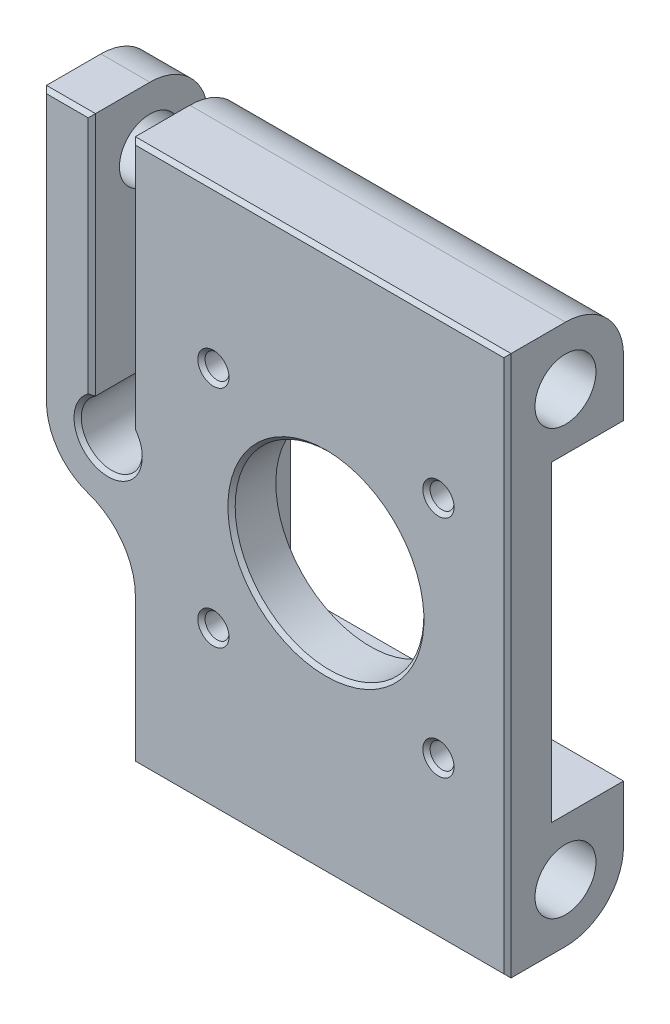
from build123d import *

# Parameters (mm, degrees)
BOSS_EXTRUDE1_DEPTH = 45.9
BOSS_EXTRUDE2_START = 5.85
BOSS_EXTRUDE2_DEPTH = 5.85
SKETCH5_R           = 13
CUT_EXTRUDE1_DEPTH  = 107.896512669
BOSS_EXTRUDE3_DEPTH = 16
CUT_EXTRUDE3_DEPTH  = 108.63296159
FILLET2_R           = 9
SKETCH6_R           = 4.2
CUT_EXTRUDE2_DEPTH  = 148.343120723
SKETCH9_R           = 1.65
CUT_EXTRUDE5_DEPTH  = 107.896512669
CIRPATTERN1_COUNT   = 4
CUT_EXTRUDE6_DEPTH  = 145.539121778
CHAMFER1_SIZE       = 0.5


with BuildPart() as part:
    # Sketch2 → Boss-Extrude1 (new body)
    with BuildSketch(Plane(origin=(0, 0, 0), x_dir=(0, 0, -1), z_dir=(1, 0, 0))):
        with BuildLine():
            Line((-75.607591408, 29.531476198), (-75.607591408, 37.281476198))
            Line((-75.607591408, 37.281476198), (-85.507591408, 37.281476198))
            Line((-85.507591408, 37.281476198), (-85.507591408, 80.281476198))
            Line((-85.507591408, 80.281476198), (-75.607591408, 80.281476198))
            Line((-75.607591408, 80.281476198), (-75.607591408, 88.031476198))
            ThreePointArc((-75.607591408, 88.031476198), (-77.950737158, 93.688330447), (-83.607591408, 96.031476198))
            Line((-83.607591408, 96.031476198), (-91.607591408, 96.031476198))
            Line((-91.607591408, 96.031476198), (-91.607591408, 21.531476198))
            Line((-91.607591408, 21.531476198), (-83.607591408, 21.531476198))
            ThreePointArc((-83.607591408, 21.531476198), (-77.950737158, 23.874621948), (-75.607591408, 29.531476198))
        make_face()
    extrude(amount=BOSS_EXTRUDE1_DEPTH)

    # Sketch3 → Boss-Extrude2 (add)
    with BuildSketch(Plane.ZY.offset(BOSS_EXTRUDE2_START)):
        with BuildLine():
            Line((75.607591408, 37.281476198), (75.607591408, 80.281476198))
            Line((75.607591408, 80.281476198), (75.607591408, 88.031476198))
            ThreePointArc((75.607591408, 88.031476198), (77.950737158, 93.688330447), (83.607591408, 96.031476198))
            Line((83.607591408, 96.031476198), (91.607591408, 96.031476198))
            Line((91.607591408, 96.031476198), (91.607591408, 21.531476198))
            Line((91.607591408, 21.531476198), (83.607591408, 21.531476198))
            ThreePointArc((83.607591408, 21.531476198), (77.950737158, 23.874621948), (75.607591408, 29.531476198))
            Line((75.607591408, 29.531476198), (75.607591408, 37.281476198))
        make_face()
    extrude(amount=-BOSS_EXTRUDE2_DEPTH)

    # Sketch5 → Cut-Extrude1 (cut, through all)
    with BuildSketch(Plane(origin=(0, 0, 85.507591408), x_dir=(-1, 0, 0), z_dir=(0, 0, -1))):
        with Locations(Location((-20.9, 58.781476198, 0), (0, 0, 90))):
            Circle(SKETCH5_R)
    extrude(amount=-CUT_EXTRUDE1_DEPTH, mode=Mode.SUBTRACT)

    # Sketch7 → Boss-Extrude3 (add)
    with BuildSketch(Plane(origin=(0, 0, 75.607591408), x_dir=(-1, 0, 0), z_dir=(0, 0, -1))):
        with BuildLine():
            ThreePointArc((5.85, 50.388771032), (14.186747487, 51.356854995), (18.1, 58.781476198))
            Line((18.1, 58.781476198), (18.1, 96.031476198))
            Line((18.1, 96.031476198), (11.35, 96.031476198))
            Line((11.35, 96.031476198), (11.35, 62.327953323))
            ThreePointArc((11.35, 62.327953323), (12.243437264, 55.996013549), (5.85, 56.121119079))
            Line((5.85, 56.121119079), (5.85, 50.388771032))
        make_face()
    extrude(amount=-BOSS_EXTRUDE3_DEPTH)

    # Sketch7<3> → Cut-Extrude3 (cut, through all)
    with BuildSketch(Plane(origin=(0, 0, 75.607591408), x_dir=(-1, 0, 0), z_dir=(0, 0, -1))):
        with BuildLine():
            ThreePointArc((5.85, 61.441833317), (4.9, 58.781476198), (5.85, 56.121119079))
            Line((5.85, 56.121119079), (5.85, 61.441833317))
        make_face()
    extrude(amount=-CUT_EXTRUDE3_DEPTH, mode=Mode.SUBTRACT)

    # Fillet2
    fillet2_edges = [part.edges().sort_by_distance(p)[0] for p in [
        (-5.85, 50.388771032, 83.607591408),
    ]]
    fillet(fillet2_edges, radius=FILLET2_R)

    # Sketch6 → Cut-Extrude2 (cut, through all)
    with BuildSketch(Plane(origin=(45.9, 0, 0), x_dir=(0, 0, -1), z_dir=(1, 0, 0))):
        with Locations((-83.607591408, 88.031476198)):
            Circle(SKETCH6_R)
        with Locations((-83.607591408, 29.531476198)):
            Circle(SKETCH6_R)
    extrude(amount=-CUT_EXTRUDE2_DEPTH, mode=Mode.SUBTRACT)

    # Sketch9 → Cut-Extrude5 (cut, through all)
    with BuildSketch(Plane(origin=(0, 0, 85.507591408), x_dir=(-1, 0, 0), z_dir=(0, 0, -1))):
        with Locations(Location((-36.4, 74.281476198, 0), (0, 0, 90))):
            Circle(SKETCH9_R)
    cut_extrude5 = extrude(amount=-CUT_EXTRUDE5_DEPTH, mode=Mode.SUBTRACT)

    # CirPattern1: Cut-Extrude5 ×4 about axis
    cirpattern1_axis = Axis((20.9, 58.781476198, 0), (0, 0, 1))
    for i in range(1, CIRPATTERN1_COUNT):
        add(cut_extrude5.rotate(cirpattern1_axis, i * 360 / CIRPATTERN1_COUNT), mode=Mode.SUBTRACT)

    # Sketch10 → Cut-Extrude6 (cut, through all)
    with BuildSketch(Plane(origin=(-11.35, 0, 0), x_dir=(0, 0, -1), z_dir=(1, 0, 0))):
        with BuildLine():
            ThreePointArc((-83.607591408, 96.031476198), (-77.950737158, 93.688330447), (-75.607591408, 88.031476198))
            Line((-75.607591408, 88.031476198), (-75.607591408, 96.031476198))
            Line((-75.607591408, 96.031476198), (-83.607591408, 96.031476198))
        make_face()
    extrude(amount=-CUT_EXTRUDE6_DEPTH, mode=Mode.SUBTRACT)

    # Chamfer1
    chamfer1_edges = [part.edges().sort_by_distance(p)[0] for p in [
        (36.4, 72.631476198, 91.607591408),
        (34.75, 43.281476198, 91.607591408),
        (5.4, 44.931476198, 91.607591408),
        (7.05, 74.281476198, 91.607591408),
        (20.025, 21.531476198, 91.607591408),
        (20.025, 96.031476198, 91.607591408),
        (45.9, 58.781476198, 91.607591408),
        (-5.85, 31.628031146, 91.607591408),
        (20.9, 45.781476198, 91.607591408),
        (-12.243437264, 55.996013549, 91.607591408),
        (-14.725, 96.031476198, 91.607591408),
        (-11.35, 79.17971476, 91.607591408),
        (-18.1, 77.406476198, 91.607591408),
        (-16.410095759, 53.531476198, 91.607591408),
        (-5.85, 78.736654757, 91.607591408),
        (-7.539904241, 46.974586094, 91.607591408),
    ]]
    chamfer(chamfer1_edges, length=CHAMFER1_SIZE)


solid = part.part
